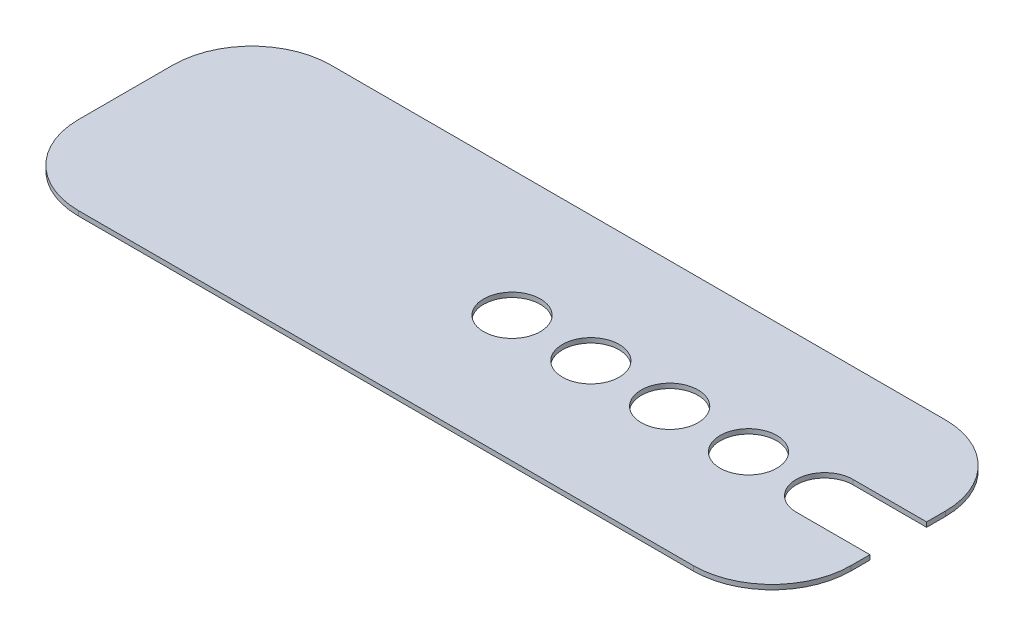
from build123d import *

# Parameters (mm, degrees)
BOSS_EXTRUDE1_DEPTH = 1.5
SKETCH2_R           = 9
CUT_EXTRUDE3_DEPTH  = 1.5


with BuildPart() as part:
    # Sketch1 → Boss-Extrude1 (new body)
    with BuildSketch(Plane(origin=(0, 0, 0), x_dir=(1, 0, 0), z_dir=(0, 1, 0))):
        with BuildLine():
            Line((-97.5, 40), (97.5, 40))
            ThreePointArc((97.5, 40), (115.17766953, 32.67766953), (122.5, 15))
            Line((122.5, 15), (122.5, -15))
            ThreePointArc((122.5, -15), (115.17766953, -32.67766953), (97.5, -40))
            Line((97.5, -40), (-97.5, -40))
            ThreePointArc((-97.5, -40), (-115.17766953, -32.67766953), (-122.5, -15))
            Line((-122.5, -15), (-122.5, 15))
            ThreePointArc((-122.5, 15), (-115.17766953, 32.67766953), (-97.5, 40))
        make_face()
    extrude(amount=BOSS_EXTRUDE1_DEPTH)

    # Sketch2 → Cut-Extrude3 (cut)
    with BuildSketch(Plane(origin=(0, 1.5, 0), x_dir=(1, 0, 0), z_dir=(0, 1, 0))):
        with Locations(Location((75, 0, 0), (0, 0, 270))):
            Circle(SKETCH2_R)
        with Locations(Location((50, 0, 0), (0, 0, 270))):
            Circle(SKETCH2_R)
        with Locations(Location((25, 0, 0), (0, 0, 270))):
            Circle(SKETCH2_R)
        with Locations(Location((0, 0, 0), (0, 0, 270))):
            Circle(SKETCH2_R)
        with BuildLine():
            Line((99.15, -9), (122.5, -9))
            Line((122.5, -9), (122.5, 9))
            Line((122.5, 9), (99.15, 9))
            ThreePointArc((99.15, 9), (90.15, 0), (99.15, -9))
        make_face()
    extrude(amount=-CUT_EXTRUDE3_DEPTH, mode=Mode.SUBTRACT)


solid = part.part
